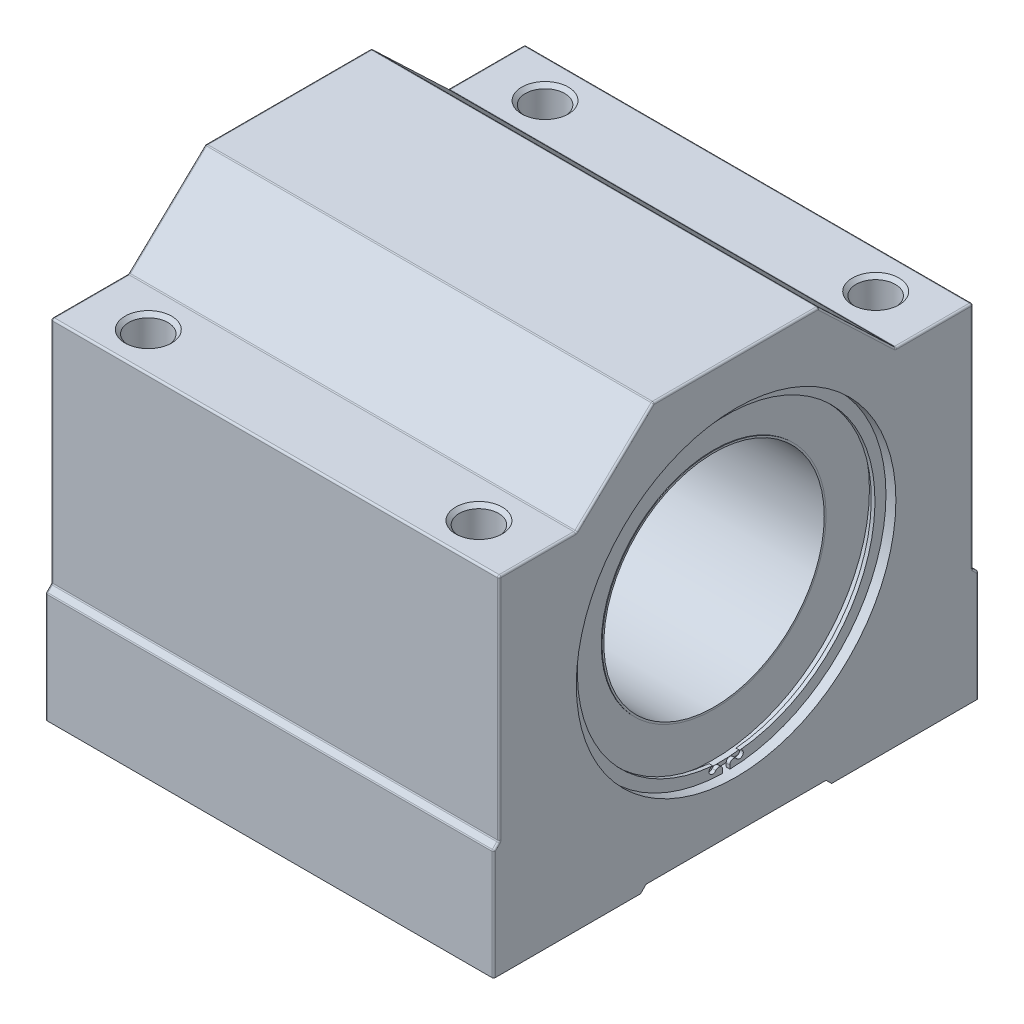
from build123d import *

# Parameters (mm, degrees)
SKETCH1_R           = 43.5
BOSS_EXTRUDE1_DEPTH = 122
EXTRUDE_THIN1_START = 0.5
SKETCH1_4_R         = 30.5
SKETCH1_4_R_2       = 30
EXTRUDE_THIN1_DEPTH = 115.5
BOSS_EXTRUDE2_START = 0.8
SKETCH1_5_R         = 42.5
SKETCH1_5_R_2       = 30
BOSS_EXTRUDE2_DEPTH = 115
BOSS_EXTRUDE3_START = 0.3
SKETCH1_6_R         = 43.5
SKETCH1_6_R_2       = 42.5
BOSS_EXTRUDE3_DEPTH = 117
BOSS_EXTRUDE4_START = 1
BOSS_EXTRUDE4_DEPTH = 1
FILLET1_R           = 0.5
SKETCH4_R           = 5.35
CUT_EXTRUDE3_DEPTH  = 180.543866506
CHAMFER1_SIZE       = 1


with BuildPart() as part:
    # Sketch1 → Boss-Extrude1 (new body)
    with BuildSketch(Plane(origin=(0, 0, 0), x_dir=(0, 0, -1), z_dir=(1, 0, 0))):
        Polygon((-66, -58), (-26, -58), (-24.5, -56.5), (24.5, -56.5), (26, -58), (66, -58), (66, -28), (64.5, -26.5), (64.5, 36), (43.5, 36), (22.5, 56), (-22.5, 56), (-43.5, 36), (-64.5, 36), (-64.5, -26.5), (-66, -28), align=None)
        Circle(SKETCH1_R, mode=Mode.SUBTRACT)
    extrude(amount=BOSS_EXTRUDE1_DEPTH)



with BuildPart() as body_2:
    # Sketch1<4> → Extrude-Thin1 (new body)
    with BuildSketch(Plane(origin=(0, 0, 0), x_dir=(0, 0, -1), z_dir=(1, 0, 0)).offset(EXTRUDE_THIN1_START)):
        Circle(SKETCH1_4_R)
        Circle(SKETCH1_4_R_2, mode=Mode.SUBTRACT)
    extrude(amount=EXTRUDE_THIN1_DEPTH)

    # Sketch1<5> → Boss-Extrude2 (add)
    with BuildSketch(Plane(origin=(0, 0, 0), x_dir=(0, 0, -1), z_dir=(1, 0, 0)).offset(BOSS_EXTRUDE2_START)):
        Circle(SKETCH1_5_R)
        Circle(SKETCH1_5_R_2, mode=Mode.SUBTRACT)
    extrude(amount=BOSS_EXTRUDE2_DEPTH)


with BuildPart() as part_1:
    add(part.part)

    add(body_2.part)  # Boss-Extrude3 merges body 2
    # Sketch1<6> → Boss-Extrude3 (add)
    with BuildSketch(Plane(origin=(0, 0, 0), x_dir=(0, 0, -1), z_dir=(1, 0, 0)).offset(BOSS_EXTRUDE3_START)):
        Circle(SKETCH1_6_R)
        Circle(SKETCH1_6_R_2, mode=Mode.SUBTRACT)
    extrude(amount=BOSS_EXTRUDE3_DEPTH)

    # Sketch3 → Boss-Extrude4 (add)
    with BuildSketch(Plane(origin=(117.3, 0, 0), x_dir=(0, 0, -1), z_dir=(1, 0, 0)).offset(BOSS_EXTRUDE4_START)):
        with BuildLine():
            Line((-1.000623377, -42.488218989), (-1.024167456, -43.487941789))
            ThreePointArc((-1.024167456, -43.487941789), (0, 43.5), (1.024167456, -43.487941789))
            Line((1.024167456, -43.487941789), (1.000623377, -42.488218989))
            ThreePointArc((1.000623377, -42.488218989), (1.691854541, -41.50157584), (2.830286494, -41.895578267))
            ThreePointArc((2.830286494, -41.895578267), (4.543509208, -41.80773439), (3.658384287, -40.338243836))
            ThreePointArc((3.658384287, -40.338243836), (0, 40.503798481), (-3.658384287, -40.338243836))
            ThreePointArc((-3.658384287, -40.338243836), (-4.543509208, -41.80773439), (-2.830286494, -41.895578267))
            ThreePointArc((-2.830286494, -41.895578267), (-1.691854541, -41.50157584), (-1.000623377, -42.488218989))
        make_face()
    extrude(amount=BOSS_EXTRUDE4_DEPTH)

    # Fillet1
    fillet1_edges = [part_1.edges().sort_by_distance(p)[0] for p in [
        (61, -26.5, -64.5),
        (61, -26.5, 64.5),
        (61, -28, 66),
        (61, -28, -66),
        (61, 36, -43.5),
        (61, 36, 43.5),
        (61, 56, 22.5),
        (61, 56, -22.5),
        (61, 36, -64.5),
        (61, 36, 64.5),
        (122, 46, -33),
        (122, 46, 33),
        (122, 4.75, 64.5),
        (0, -27.25, 65.25),
        (0, 46, 33),
        (122, -27.25, -65.25),
        (122, -43, -66),
        (122, 4.75, -64.5),
        (122, 56, 0),
        (122, 36, -54),
        (122, 36, 54),
        (122, -27.25, 65.25),
        (122, -43, 66),
        (0, -43, -66),
        (0, -27.25, -65.25),
        (0, 4.75, -64.5),
        (0, 46, -33),
        (0, 36, -54),
        (0, 56, 0),
        (0, -43, 66),
        (0, 4.75, 64.5),
        (0, 36, 54),
    ]]
    fillet(fillet1_edges, radius=FILLET1_R)

    # Sketch4 → Cut-Extrude3 (cut, through all)
    with BuildSketch(Plane.XZ.offset(58)):
        with Locations((16, 54)):
            Circle(SKETCH4_R)
        with Locations((106, 54)):
            Circle(SKETCH4_R)
        with Locations((106, -54)):
            Circle(SKETCH4_R)
        with Locations((16, -54)):
            Circle(SKETCH4_R)
    extrude(amount=-CUT_EXTRUDE3_DEPTH, mode=Mode.SUBTRACT)

    # Chamfer1
    chamfer1_edges = [part_1.edges().sort_by_distance(p)[0] for p in [
        (100.65, 36, -54),
        (10.65, 36, -54),
        (10.65, 36, 54),
        (100.65, 36, 54),
        (100.65, -58, 54),
        (10.65, -58, 54),
    ]]
    chamfer(chamfer1_edges, length=CHAMFER1_SIZE)


solid = part_1.part
